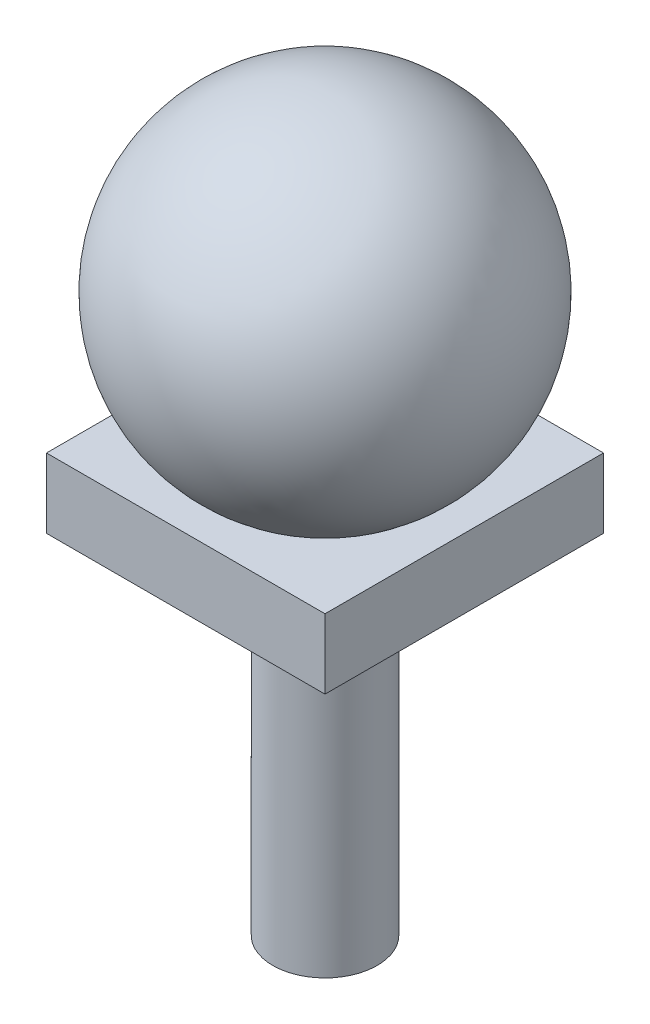
from build123d import *

# Parameters (mm, degrees)
SKETCH1_W           = 1.5
SKETCH1_H           = 11
SKETCH2_W           = 8
SKETCH2_H           = 8
BOSS_EXTRUDE1_DEPTH = 2


with BuildPart() as part:
    # Sketch1 → Revolve1 (revolve)
    with BuildSketch(Plane.XY):
        with BuildLine():
            Line((0, -5), (-1.5, -5))
            Line((-1.5, -5), (-1.5, -4.769696007))
            ThreePointArc((-1.5, -4.769696007), (-4.942088629, 0.758788496), (0, 5))
            Line((0, 5), (0, -5))
        make_face()
        with Locations((-0.75, -10.5)):
            Rectangle(SKETCH1_W, SKETCH1_H)
    revolve(axis=Axis((0, 5, 0), (0, -1, 0)))

    # Sketch2 → Boss-Extrude1 (add)
    with BuildSketch(Plane(origin=(0, -6, 0), x_dir=(-1, 0, 0), z_dir=(0, -1, 0))):
        Rectangle(SKETCH2_W, SKETCH2_H)
    extrude(amount=-BOSS_EXTRUDE1_DEPTH)


solid = part.part
